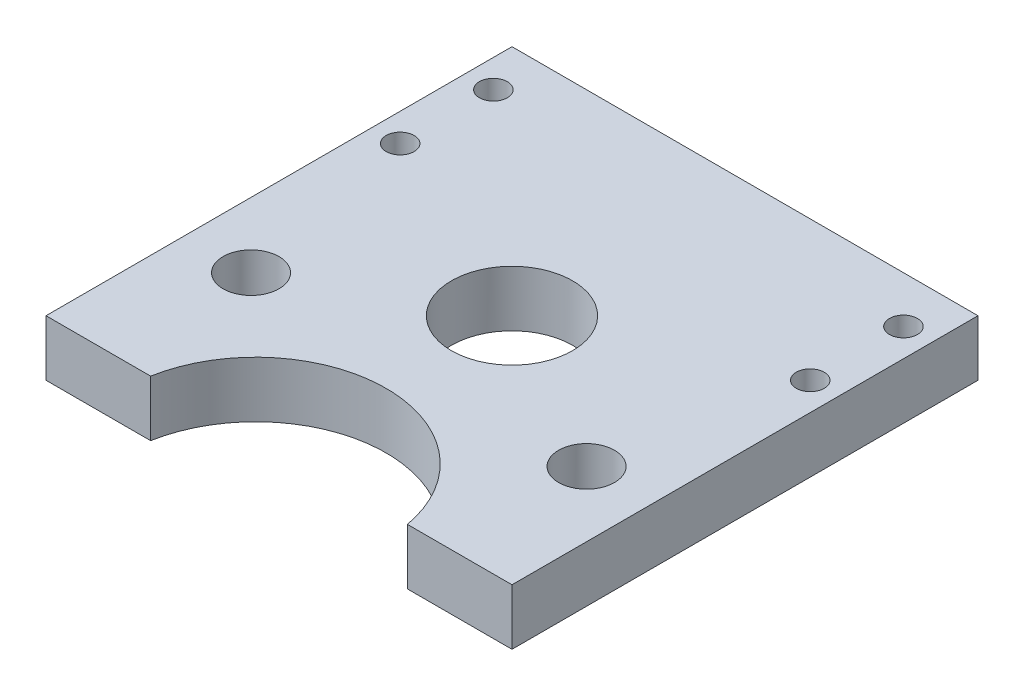
from build123d import *

# Parameters (mm, degrees)
SKETCH1_W           = 100
SKETCH1_H           = 100
BOSS_EXTRUDE1_DEPTH = 12
CUT_EXTRUDE1_REACH  = 88.856
SKETCH2_R           = 3
CUT_EXTRUDE2_REACH  = 88.856
SKETCH3_R           = 13
CUT_EXTRUDE3_REACH  = 88.856
SKETCH4_R           = 6
CUT_EXTRUDE4_REACH  = 88.856
SKETCH5_R           = 28


with BuildPart() as part:
    # Sketch1 → Boss-Extrude1 (new body)
    with BuildSketch(Plane(origin=(0, 0, 0), x_dir=(1, 0, 0), z_dir=(0, 1, 0))):
        with Locations((0, -20)):
            Rectangle(SKETCH1_W, SKETCH1_H)
    extrude(amount=BOSS_EXTRUDE1_DEPTH)

    # Sketch2 → Cut-Extrude1 (cut, up to next)
    with BuildSketch(Plane(origin=(0, 12, 0), x_dir=(1, 0, 0), z_dir=(0, 1, 0)), mode=Mode.PRIVATE) as cut_extrude1_sk1:
        with Locations(Location((-44, 20, 0), (0, 0, 270))):
            Circle(SKETCH2_R)
    cut_extrude1_tool1 = extrude(cut_extrude1_sk1.sketch, amount=-CUT_EXTRUDE1_REACH, mode=Mode.PRIVATE) & part.part
    # Sketch2 → Cut-Extrude1 (cut, up to next)
    with BuildSketch(Plane(origin=(0, 12, 0), x_dir=(1, 0, 0), z_dir=(0, 1, 0)), mode=Mode.PRIVATE) as cut_extrude1_sk2:
        with Locations(Location((-44, 0, 0), (0, 0, 270))):
            Circle(SKETCH2_R)
    cut_extrude1_tool2 = extrude(cut_extrude1_sk2.sketch, amount=-CUT_EXTRUDE1_REACH, mode=Mode.PRIVATE) & part.part
    # Sketch2 → Cut-Extrude1 (cut, up to next)
    with BuildSketch(Plane(origin=(0, 12, 0), x_dir=(1, 0, 0), z_dir=(0, 1, 0)), mode=Mode.PRIVATE) as cut_extrude1_sk3:
        with Locations(Location((44, 20, 0), (0, 0, 270))):
            Circle(SKETCH2_R)
    cut_extrude1_tool3 = extrude(cut_extrude1_sk3.sketch, amount=-CUT_EXTRUDE1_REACH, mode=Mode.PRIVATE) & part.part
    # Sketch2 → Cut-Extrude1 (cut, up to next)
    with BuildSketch(Plane(origin=(0, 12, 0), x_dir=(1, 0, 0), z_dir=(0, 1, 0)), mode=Mode.PRIVATE) as cut_extrude1_sk4:
        with Locations(Location((44, 0, 0), (0, 0, 270))):
            Circle(SKETCH2_R)
    cut_extrude1_tool4 = extrude(cut_extrude1_sk4.sketch, amount=-CUT_EXTRUDE1_REACH, mode=Mode.PRIVATE) & part.part
    add(cut_extrude1_tool1.solids().sort_by_distance((-44, 12, -20))[0], mode=Mode.SUBTRACT)
    add(cut_extrude1_tool2.solids().sort_by_distance((-44, 12, 0))[0], mode=Mode.SUBTRACT)
    add(cut_extrude1_tool3.solids().sort_by_distance((44, 12, -20))[0], mode=Mode.SUBTRACT)
    add(cut_extrude1_tool4.solids().sort_by_distance((44, 12, 0))[0], mode=Mode.SUBTRACT)

    # Sketch3 → Cut-Extrude2 (cut, up to next)
    with BuildSketch(Plane(origin=(0, 12, 0), x_dir=(1, 0, 0), z_dir=(0, 1, 0)), mode=Mode.PRIVATE) as cut_extrude2_sk1:
        with Locations(Location((0, -20, 0), (0, 0, 270))):
            Circle(SKETCH3_R)
    cut_extrude2_tool1 = extrude(cut_extrude2_sk1.sketch, amount=-CUT_EXTRUDE2_REACH, mode=Mode.PRIVATE) & part.part
    add(cut_extrude2_tool1.solids().sort_by_distance((0, 12, 20))[0], mode=Mode.SUBTRACT)

    # Sketch4 → Cut-Extrude3 (cut, up to next)
    with BuildSketch(Plane(origin=(0, 12, 0), x_dir=(1, 0, 0), z_dir=(0, 1, 0)), mode=Mode.PRIVATE) as cut_extrude3_sk1:
        with Locations(Location((-36, -40, 0), (0, 0, 270))):
            Circle(SKETCH4_R)
    cut_extrude3_tool1 = extrude(cut_extrude3_sk1.sketch, amount=-CUT_EXTRUDE3_REACH, mode=Mode.PRIVATE) & part.part
    # Sketch4 → Cut-Extrude3 (cut, up to next)
    with BuildSketch(Plane(origin=(0, 12, 0), x_dir=(1, 0, 0), z_dir=(0, 1, 0)), mode=Mode.PRIVATE) as cut_extrude3_sk2:
        with Locations(Location((36, -40, 0), (0, 0, 270))):
            Circle(SKETCH4_R)
    cut_extrude3_tool2 = extrude(cut_extrude3_sk2.sketch, amount=-CUT_EXTRUDE3_REACH, mode=Mode.PRIVATE) & part.part
    add(cut_extrude3_tool1.solids().sort_by_distance((-36, 12, 40))[0], mode=Mode.SUBTRACT)
    add(cut_extrude3_tool2.solids().sort_by_distance((36, 12, 40))[0], mode=Mode.SUBTRACT)

    # Sketch5 → Cut-Extrude4 (cut, up to next)
    with BuildSketch(Plane(origin=(0, 12, 0), x_dir=(1, 0, 0), z_dir=(0, 1, 0)), mode=Mode.PRIVATE) as cut_extrude4_sk1:
        with Locations((0, -75)):
            Circle(SKETCH5_R)
    cut_extrude4_tool1 = extrude(cut_extrude4_sk1.sketch, amount=-CUT_EXTRUDE4_REACH, mode=Mode.PRIVATE) & part.part
    add(cut_extrude4_tool1.solids().sort_by_distance((0, 12, 75))[0], mode=Mode.SUBTRACT)


solid = part.part
